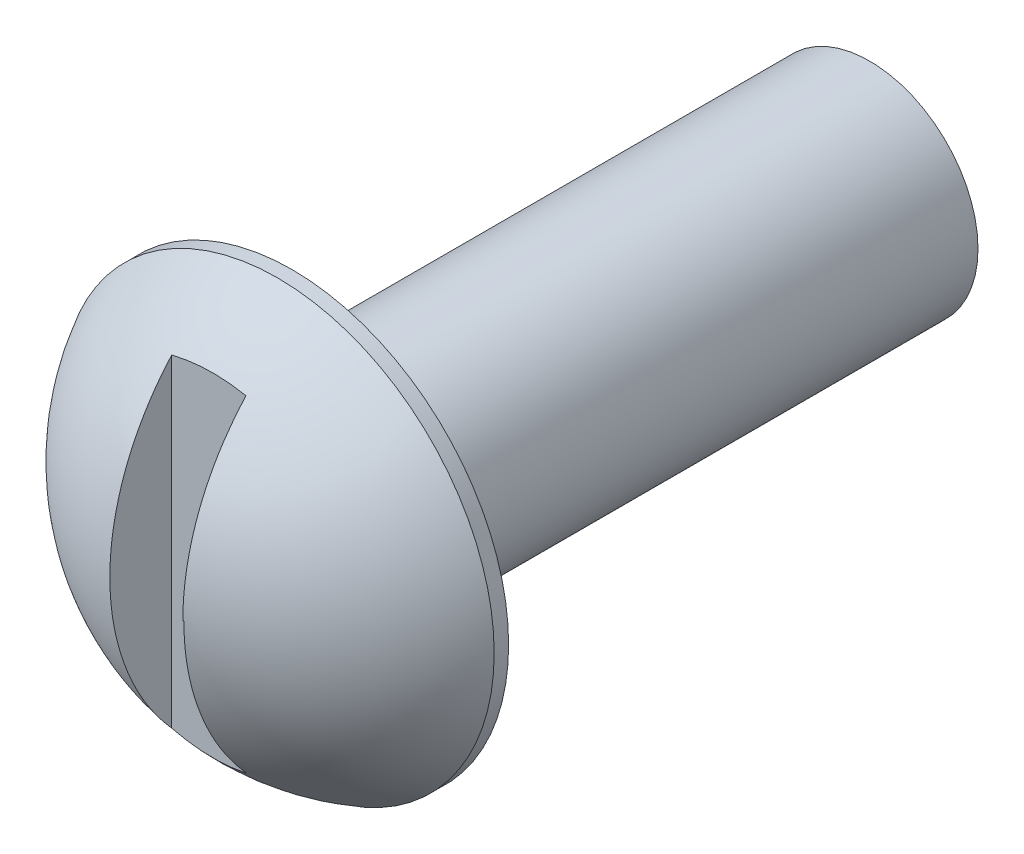
from build123d import *

# Parameters (mm, degrees)
SKETCH_1_R          = 1.5
EXTRUDE_1_DEPTH     = 8
SKETCH_2_R          = 3
EXTRUDE_2_DEPTH     = 0.2
DOME_1_FACE_RADIUS  = 3
DOME_1_HEIGHT       = 1.8
SKETCH_4_W          = 1.040451318
SKETCH_4_H          = 2.30386654
CUT_EXTRUDE_3_DEPTH = 50
SKETCH_7_W          = 1.027378529
SKETCH_7_H          = 1.803274818
CUT_EXTRUDE_6_DEPTH = 50


with BuildPart() as part:
    # Эскиз1 → Вытянуть1 (new body)
    with BuildSketch(Plane.XY):
        Circle(SKETCH_1_R)
    extrude(amount=EXTRUDE_1_DEPTH)

    # Эскиз2 → Вытянуть2 (add)
    with BuildSketch(Plane.XY.offset(8)):
        Circle(SKETCH_2_R)
    extrude(amount=EXTRUDE_2_DEPTH)

    # Купол1: a dome of height H over a round flat face of radius A is a cap of a sphere of radius (A * A + H * H) / (2 * H)
    dome_1_r = (DOME_1_FACE_RADIUS * DOME_1_FACE_RADIUS + DOME_1_HEIGHT * DOME_1_HEIGHT) / (2 * DOME_1_HEIGHT)
    dome_1_base = Plane((0, 0, 8.2), z_dir=(0, 0, 1))
    with Locations(dome_1_base.offset(DOME_1_HEIGHT - dome_1_r)):
        dome_1_ball = Sphere(dome_1_r, mode=Mode.PRIVATE)
    add(split(dome_1_ball, bisect_by=dome_1_base, keep=Keep.TOP, mode=Mode.PRIVATE))

    # Эскиз4 → Вырез-Вытянуть3 (cut)
    with BuildSketch(Plane(origin=(0, 0, 0), x_dir=(1, 0, 0), z_dir=(0, 1, 0))):
        with Locations((-0.049545301, -10.24795251)):
            Rectangle(SKETCH_4_W, SKETCH_4_H)
    extrude(amount=-CUT_EXTRUDE_3_DEPTH, mode=Mode.SUBTRACT)

    # Эскиз7 → Вырез-Вытянуть6 (cut)
    with BuildSketch(Plane.XZ):
        with Locations((-0.056081696, 9.997656649)):
            Rectangle(SKETCH_7_W, SKETCH_7_H)
    extrude(amount=-CUT_EXTRUDE_6_DEPTH, mode=Mode.SUBTRACT)


solid = part.part
